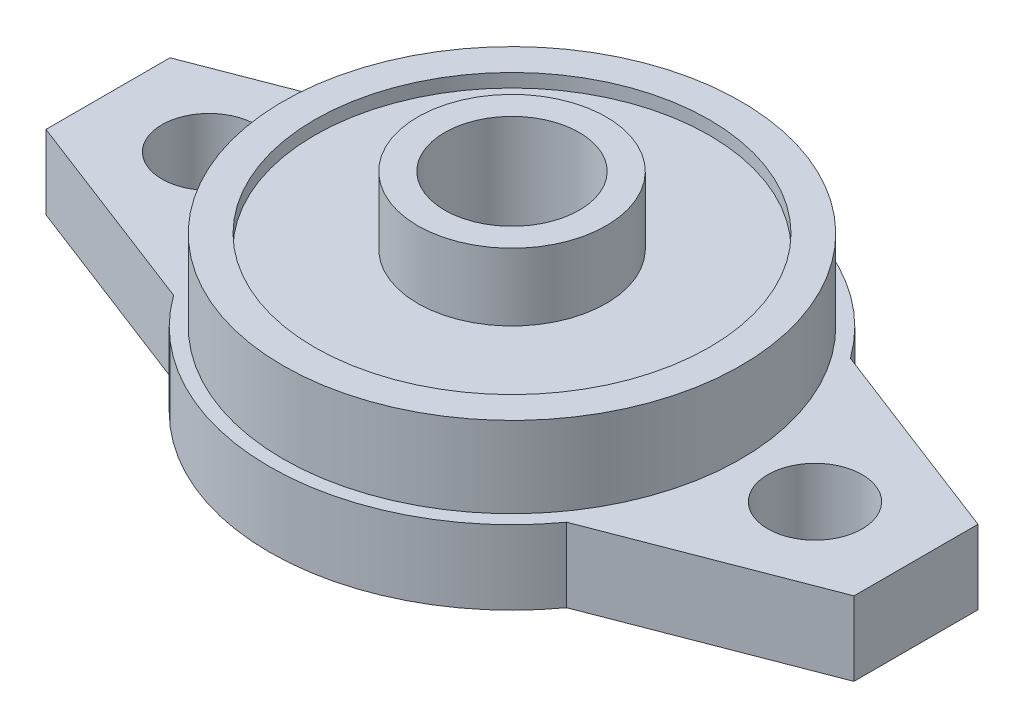
from build123d import *

# Parameters (mm, degrees)
SKETCH_1_R          = 3.5
SKETCH_1_R_2        = 18
SKETCH_1_R_3        = 5
EXTRUDE_1_DEPTH     = 5.5
SKETCH_2_R          = 17
SKETCH_2_R_2        = 5
EXTRUDE_2_DEPTH     = 6
SKETCH_3_R          = 7
SKETCH_3_R_2        = 5
EXTRUDE_3_DEPTH     = 4
CUT_EXTRUDE_START   = -1
SKETCH_4_R          = 14.65
SKETCH_4_R_2        = 7
CUT_EXTRUDE_1_DEPTH = 1


with BuildPart() as part:
    # 草图1 → 凸台-拉伸1 (new body)
    # profile 1 of 3: a face of its own
    with BuildSketch(Plane(origin=(0, 0, 0), x_dir=(1, 0, 0), z_dir=(0, 1, 0))):
        with BuildLine():
            Line((-14.5934987, 10.537067699), (-30, 4.60495562))
            Line((-30, 4.60495562), (-30, -4.60495562))
            Line((-30, -4.60495562), (-14.5934987, -10.537067699))
            ThreePointArc((-14.5934987, -10.537067699), (-18, 0), (-14.5934987, 10.537067699))
        make_face()
        with Locations(Location((-22.5, 0, 0), (0, 0, 270))):
            Circle(SKETCH_1_R, mode=Mode.SUBTRACT)
    # profile 2 of 3: a face of its own
    with BuildSketch(Plane(origin=(0, 0, 0), x_dir=(1, 0, 0), z_dir=(0, 1, 0))):
        Circle(SKETCH_1_R_2)
        with Locations(Location((0, 0, 0), (0, 0, 270))):
            Circle(SKETCH_1_R_3, mode=Mode.SUBTRACT)
    # profile 3 of 3: a face of its own
    with BuildSketch(Plane(origin=(0, 0, 0), x_dir=(1, 0, 0), z_dir=(0, 1, 0))):
        with BuildLine():
            Line((30, 4.60495562), (14.5934987, 10.537067699))
            ThreePointArc((14.5934987, 10.537067699), (17.127214844, 5.537012886), (18, 0))
            ThreePointArc((18, 0), (17.127214844, -5.537012886), (14.5934987, -10.537067699))
            Line((14.5934987, -10.537067699), (30, -4.60495562))
            Line((30, -4.60495562), (30, 4.60495562))
        make_face()
        with Locations(Location((22.5, 0, 0), (0, 0, 270))):
            Circle(SKETCH_1_R, mode=Mode.SUBTRACT)
    extrude(amount=EXTRUDE_1_DEPTH)

    # 草图2 → 凸台-拉伸2 (add)
    with BuildSketch(Plane(origin=(0, 5.5, 0), x_dir=(1, 0, 0), z_dir=(0, 1, 0))):
        with Locations(Location((0, 0, 0), (0, 0, 270))):
            Circle(SKETCH_2_R)
        with Locations(Location((0, 0, 0), (0, 0, 270))):
            Circle(SKETCH_2_R_2, mode=Mode.SUBTRACT)
    extrude(amount=EXTRUDE_2_DEPTH)

    # 草图3 → 凸台-拉伸3 (add)
    with BuildSketch(Plane(origin=(0, 11.5, 0), x_dir=(1, 0, 0), z_dir=(0, 1, 0))):
        with Locations(Location((0, 0, 0), (0, 0, 270))):
            Circle(SKETCH_3_R)
        with Locations(Location((0, 0, 0), (0, 0, 270))):
            Circle(SKETCH_3_R_2, mode=Mode.SUBTRACT)
    extrude(amount=EXTRUDE_3_DEPTH)

    # 草图4 → 切除-拉伸1 (cut)
    with BuildSketch(Plane(origin=(0, 11.5, 0), x_dir=(1, 0, 0), z_dir=(0, 1, 0)).offset(CUT_EXTRUDE_START)):
        with Locations(Location((0, 0, 0), (0, 0, 270))):
            Circle(SKETCH_4_R)
        with Locations(Location((0, 0, 0), (0, 0, 270))):
            Circle(SKETCH_4_R_2, mode=Mode.SUBTRACT)
    extrude(amount=CUT_EXTRUDE_1_DEPTH, mode=Mode.SUBTRACT)


solid = part.part
